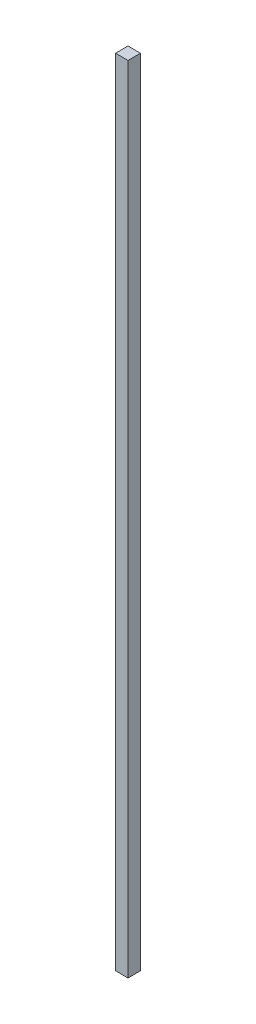
from build123d import *

# Parameters (mm, degrees)
SKETCH_1_W      = 50
SKETCH_1_H      = 50
EXTRUDE_1_DEPTH = 3180


with BuildPart() as part:
    # Эскиз1 → Бобышка-Вытянуть1 (new body)
    with BuildSketch(Plane(origin=(0, 0, 0), x_dir=(1, 0, 0), z_dir=(0, 1, 0))):
        with Locations((-17.531066264, -8.324646433)):
            Rectangle(SKETCH_1_W, SKETCH_1_H)
    extrude(amount=EXTRUDE_1_DEPTH)


solid = part.part
